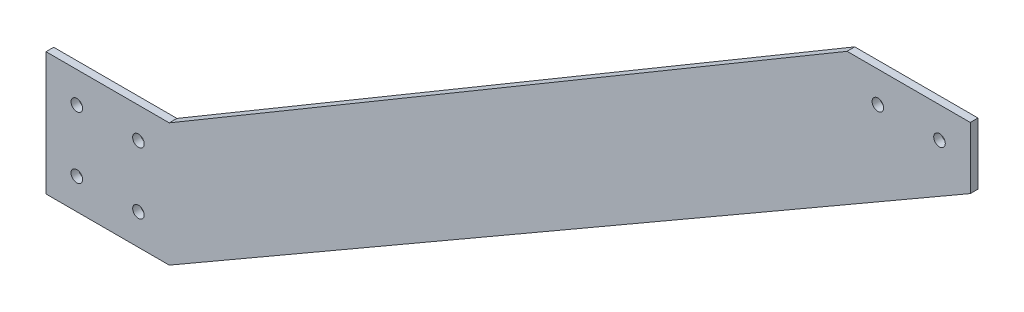
from build123d import *

# Parameters (mm, degrees)
BOSS_EXTRUDE1_DEPTH = 3.175
SKETCH3_R           = 2.38125
CUT_EXTRUDE1_DEPTH  = 439.000935786


with BuildPart() as part:
    # Sketch2 → Boss-Extrude1 (new body)
    with BuildSketch(Plane.XY):
        Polygon((50.8, 0), (381, 190.641058886), (381, 216.041058886), (330.2, 216.041058886), (50.8, 50.8), (0, 50.8), (0, 0), align=None)
    extrude(amount=BOSS_EXTRUDE1_DEPTH)

    # Sketch3 → Cut-Extrude1 (cut, through all)
    with BuildSketch(Plane.XY.offset(3.175)):
        with Locations((12.7, 12.7)):
            Circle(SKETCH3_R)
        with Locations((12.7, 38.1)):
            Circle(SKETCH3_R)
        with Locations(Location((342.9, 203.341058886, 0), (0, 0, 180))):
            Circle(SKETCH3_R)
        with Locations(Location((368.3, 203.341058886, 0), (0, 0, 180))):
            Circle(SKETCH3_R)
        with Locations((38.1, 12.7)):
            Circle(SKETCH3_R)
        with Locations((38.1, 38.1)):
            Circle(SKETCH3_R)
    extrude(amount=-CUT_EXTRUDE1_DEPTH, mode=Mode.SUBTRACT)


solid = part.part
